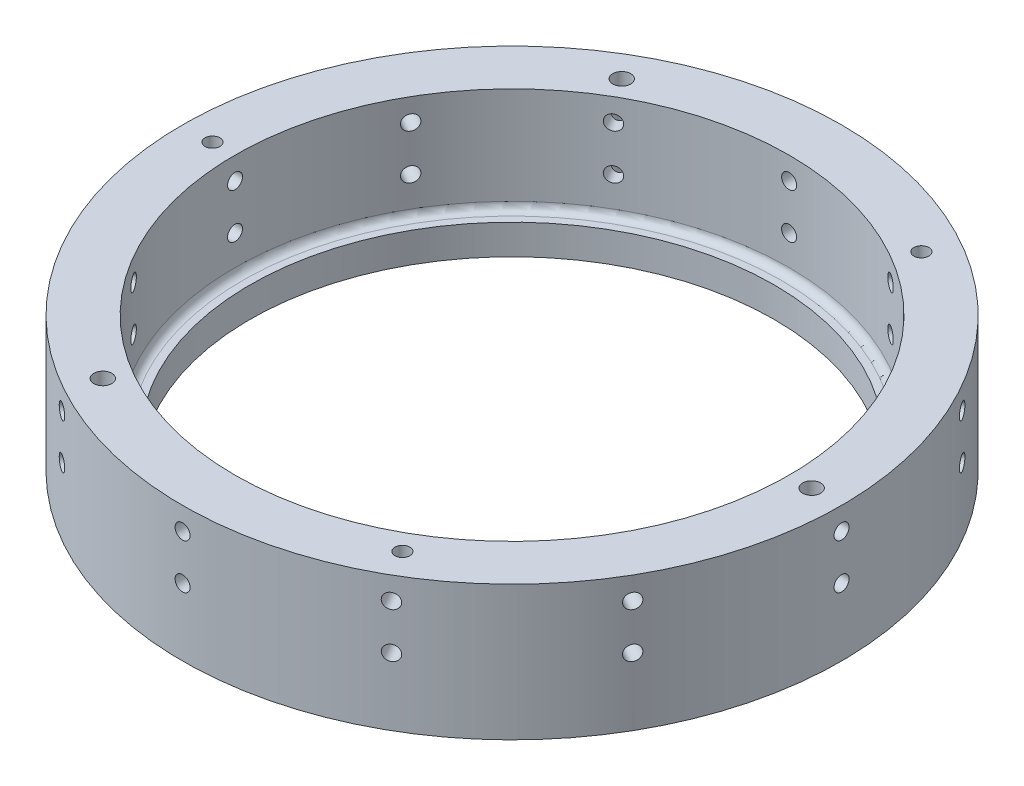
from build123d import *

# Parameters (mm, degrees)
SKETCH_2_R                          = 3
CUT_EXTRUDE_1_DEPTH                 = 162.941347407
SKETCH_8_W                          = 2.5
SKETCH_8_H                          = 110
HOLE_WIZARD_M6_3_AT_2_COUNT         = 2
HOLE_WIZARD_M6_3_AT_2_PITCH         = 15
SKETCH_9_R                          = 2.5
CUT_EXTRUDE_2_DEPTH                 = 162.941347571
PATTERN_CIRCULAR_1_COUNT            = 3
FILLET_1_R                          = 2.5
PATTERN_CIRCULAR_2_COUNT            = 12
PATTERN_CIRCULAR_2_COPY_1_SKETCH_W  = 2.5
PATTERN_CIRCULAR_2_COPY_1_SKETCH_H  = 110
PATTERN_CIRCULAR_2_COPY_2_SKETCH_W  = 2.5
PATTERN_CIRCULAR_2_COPY_2_SKETCH_H  = 110
PATTERN_CIRCULAR_2_COPY_3_SKETCH_W  = 2.5
PATTERN_CIRCULAR_2_COPY_3_SKETCH_H  = 110
PATTERN_CIRCULAR_2_COPY_4_SKETCH_W  = 2.5
PATTERN_CIRCULAR_2_COPY_4_SKETCH_H  = 110
PATTERN_CIRCULAR_2_COPY_5_SKETCH_W  = 2.5
PATTERN_CIRCULAR_2_COPY_5_SKETCH_H  = 110
PATTERN_CIRCULAR_2_COPY_6_SKETCH_W  = 2.5
PATTERN_CIRCULAR_2_COPY_6_SKETCH_H  = 110
PATTERN_CIRCULAR_2_COPY_7_SKETCH_W  = 2.5
PATTERN_CIRCULAR_2_COPY_7_SKETCH_H  = 110
PATTERN_CIRCULAR_2_COPY_8_SKETCH_W  = 2.5
PATTERN_CIRCULAR_2_COPY_8_SKETCH_H  = 110
PATTERN_CIRCULAR_2_COPY_9_SKETCH_W  = 2.5
PATTERN_CIRCULAR_2_COPY_9_SKETCH_H  = 110
PATTERN_CIRCULAR_2_COPY_10_SKETCH_W = 2.5
PATTERN_CIRCULAR_2_COPY_10_SKETCH_H = 110
PATTERN_CIRCULAR_2_COPY_11_SKETCH_W = 2.5
PATTERN_CIRCULAR_2_COPY_11_SKETCH_H = 110


with BuildPart() as part:
    # 草图1 → 旋转1 (revolve)
    with BuildSketch(Plane(origin=(0, 0, 0), x_dir=(0, 0, -1), z_dir=(1, 0, 0)), mode=Mode.PRIVATE) as revolve_1_sk:
        Polygon((-110, 45), (-110, 0), (-87.5, 0), (-87.5, 10), (-92.5, 10), (-92.5, 45), align=None)
    revolve(revolve_1_sk.sketch.rotate(Axis((0, 0, 0), (0, 1, 0)), 180), axis=Axis((0, 0, 0), (0, 1, 0)))

    # 草图2 → 切除-拉伸1 (cut, through all)
    with BuildSketch(Plane(origin=(0, 45, 0), x_dir=(1, 0, 0), z_dir=(0, 1, 0))):
        with Locations(Location((100, 0, 0), (0, 0, 270))):
            Circle(SKETCH_2_R)
    cut_extrude_1 = extrude(amount=-CUT_EXTRUDE_1_DEPTH, mode=Mode.SUBTRACT)

    # 草图4 → M6 螺纹孔1 (revolve, cut)
    with BuildSketch(Plane(origin=(-100, 45, 0), x_dir=(0, 0, 1), z_dir=(1, 0, 0))):
        Polygon((0, 0), (0, 16.502151548), (2.5, 15), (2.5, 0), align=None)
    hole_wizard_m6_1 = revolve(axis=Axis((-100, 51.35, 0), (0, -1, 0)), mode=Mode.SUBTRACT)

    # 草图8 → M6 螺纹孔3 (revolve, cut)
    with BuildSketch(Plane(origin=(0, 37.5, 0), x_dir=(0, 1, 0), z_dir=(1, 0, 0))):
        with Locations((1.25, 55)):
            Rectangle(SKETCH_8_W, SKETCH_8_H)
    hole_wizard_m6_3 = revolve(axis=Axis((0, 37.5, -6.35), (0, 0, 1)), mode=Mode.SUBTRACT)

    # M6 螺纹孔3 at 2: M6 螺纹孔3 ×2
    with Locations(*[(0, -i * HOLE_WIZARD_M6_3_AT_2_PITCH, 0) for i in range(1, HOLE_WIZARD_M6_3_AT_2_COUNT)]):
        add(hole_wizard_m6_3, mode=Mode.SUBTRACT)

    # 草图9 → 切除-拉伸2 (cut, through all)
    with BuildSketch(Plane(origin=(0, 45, 0), x_dir=(1, 0, 0), z_dir=(0, 1, 0))):
        with Locations(Location((-100, 0, 0), (0, 0, 270))):
            Circle(SKETCH_9_R)
    cut_extrude_2 = extrude(amount=-CUT_EXTRUDE_2_DEPTH, mode=Mode.SUBTRACT)

    # 阵列(圆周)1: 切除-拉伸1, M6 螺纹孔1, 切除-拉伸2 ×3 about axis
    pattern_circular_1_axis = Axis((0, 0, 0), (0, 1, 0))
    add([cut_extrude_1.rotate(pattern_circular_1_axis, i * 360 / PATTERN_CIRCULAR_1_COUNT) for i in range(1, PATTERN_CIRCULAR_1_COUNT)], mode=Mode.SUBTRACT)
    add([hole_wizard_m6_1.rotate(pattern_circular_1_axis, i * 360 / PATTERN_CIRCULAR_1_COUNT) for i in range(1, PATTERN_CIRCULAR_1_COUNT)], mode=Mode.SUBTRACT)
    add([cut_extrude_2.rotate(pattern_circular_1_axis, i * 360 / PATTERN_CIRCULAR_1_COUNT) for i in range(1, PATTERN_CIRCULAR_1_COUNT)], mode=Mode.SUBTRACT)

    # 圆角1
    fillet_1_edges = [part.edges().sort_by_distance(p)[0] for p in [
        (0, 10, 92.5),
    ]]
    fillet(fillet_1_edges, radius=FILLET_1_R)

    # 阵列(圆周)2: M6 螺纹孔3 ×12 about axis
    pattern_circular_2_axis = Axis((0, 0, 0), (0, -1, 0))
    for i in range(1, PATTERN_CIRCULAR_2_COUNT):
        add(hole_wizard_m6_3.rotate(pattern_circular_2_axis, i * 360 / PATTERN_CIRCULAR_2_COUNT), mode=Mode.SUBTRACT)

    # 阵列(圆周)2 copy 1 sketch → 阵列(圆周)2 copy 1 (revolve, cut)
    with BuildSketch(Plane(origin=(0, 22.5, 0), x_dir=(0, 1, 0), z_dir=(0.8660254037844387, 0, 0.49999999999999994))):
        with Locations((1.25, 55)):
            Rectangle(PATTERN_CIRCULAR_2_COPY_1_SKETCH_W, PATTERN_CIRCULAR_2_COPY_1_SKETCH_H)
    revolve(axis=Axis((3.175, 22.5, -5.499261314), (-0.49999999999999994, 0, 0.8660254037844387)), mode=Mode.SUBTRACT)

    # 阵列(圆周)2 copy 2 sketch → 阵列(圆周)2 copy 2 (revolve, cut)
    with BuildSketch(Plane(origin=(0, 22.5, 0), x_dir=(0, 1, 0), z_dir=(0.5000000000000001, 0, 0.8660254037844386))):
        with Locations((1.25, 55)):
            Rectangle(PATTERN_CIRCULAR_2_COPY_2_SKETCH_W, PATTERN_CIRCULAR_2_COPY_2_SKETCH_H)
    revolve(axis=Axis((5.499261314, 22.5, -3.175), (-0.8660254037844386, 0, 0.5000000000000001)), mode=Mode.SUBTRACT)

    # 阵列(圆周)2 copy 3 sketch → 阵列(圆周)2 copy 3 (revolve, cut)
    with BuildSketch(Plane(origin=(0, 22.5, 0), x_dir=(0, 1, 0), z_dir=(0, 0, 1))):
        with Locations((1.25, 55)):
            Rectangle(PATTERN_CIRCULAR_2_COPY_3_SKETCH_W, PATTERN_CIRCULAR_2_COPY_3_SKETCH_H)
    revolve(axis=Axis((6.35, 22.5, 0), (-1, 0, 0)), mode=Mode.SUBTRACT)

    # 阵列(圆周)2 copy 4 sketch → 阵列(圆周)2 copy 4 (revolve, cut)
    with BuildSketch(Plane(origin=(0, 22.5, 0), x_dir=(0, 1, 0), z_dir=(-0.4999999999999998, 0, 0.8660254037844387))):
        with Locations((1.25, 55)):
            Rectangle(PATTERN_CIRCULAR_2_COPY_4_SKETCH_W, PATTERN_CIRCULAR_2_COPY_4_SKETCH_H)
    revolve(axis=Axis((5.499261314, 22.5, 3.175), (-0.8660254037844387, 0, -0.4999999999999998)), mode=Mode.SUBTRACT)

    # 阵列(圆周)2 copy 5 sketch → 阵列(圆周)2 copy 5 (revolve, cut)
    with BuildSketch(Plane(origin=(0, 22.5, 0), x_dir=(0, 1, 0), z_dir=(-0.8660254037844387, 0, 0.49999999999999994))):
        with Locations((1.25, 55)):
            Rectangle(PATTERN_CIRCULAR_2_COPY_5_SKETCH_W, PATTERN_CIRCULAR_2_COPY_5_SKETCH_H)
    revolve(axis=Axis((3.175, 22.5, 5.499261314), (-0.49999999999999994, 0, -0.8660254037844387)), mode=Mode.SUBTRACT)

    # 阵列(圆周)2 copy 6 sketch → 阵列(圆周)2 copy 6 (revolve, cut)
    with BuildSketch(Plane(origin=(0, 22.5, 0), x_dir=(0, 1, 0), z_dir=(-1, 0, 0))):
        with Locations((1.25, 55)):
            Rectangle(PATTERN_CIRCULAR_2_COPY_6_SKETCH_W, PATTERN_CIRCULAR_2_COPY_6_SKETCH_H)
    revolve(axis=Axis((0, 22.5, 6.35), (0, 0, -1)), mode=Mode.SUBTRACT)

    # 阵列(圆周)2 copy 7 sketch → 阵列(圆周)2 copy 7 (revolve, cut)
    with BuildSketch(Plane(origin=(0, 22.5, 0), x_dir=(0, 1, 0), z_dir=(-0.8660254037844386, 0, -0.5000000000000001))):
        with Locations((1.25, 55)):
            Rectangle(PATTERN_CIRCULAR_2_COPY_7_SKETCH_W, PATTERN_CIRCULAR_2_COPY_7_SKETCH_H)
    revolve(axis=Axis((-3.175, 22.5, 5.499261314), (0.5000000000000001, 0, -0.8660254037844386)), mode=Mode.SUBTRACT)

    # 阵列(圆周)2 copy 8 sketch → 阵列(圆周)2 copy 8 (revolve, cut)
    with BuildSketch(Plane(origin=(0, 22.5, 0), x_dir=(0, 1, 0), z_dir=(-0.5000000000000004, 0, -0.8660254037844384))):
        with Locations((1.25, 55)):
            Rectangle(PATTERN_CIRCULAR_2_COPY_8_SKETCH_W, PATTERN_CIRCULAR_2_COPY_8_SKETCH_H)
    revolve(axis=Axis((-5.499261314, 22.5, 3.175), (0.8660254037844384, 0, -0.5000000000000004)), mode=Mode.SUBTRACT)

    # 阵列(圆周)2 copy 9 sketch → 阵列(圆周)2 copy 9 (revolve, cut)
    with BuildSketch(Plane(origin=(0, 22.5, 0), x_dir=(0, 1, 0), z_dir=(0, 0, -1))):
        with Locations((1.25, 55)):
            Rectangle(PATTERN_CIRCULAR_2_COPY_9_SKETCH_W, PATTERN_CIRCULAR_2_COPY_9_SKETCH_H)
    revolve(axis=Axis((-6.35, 22.5, 0), (1, 0, 0)), mode=Mode.SUBTRACT)

    # 阵列(圆周)2 copy 10 sketch → 阵列(圆周)2 copy 10 (revolve, cut)
    with BuildSketch(Plane(origin=(0, 22.5, 0), x_dir=(0, 1, 0), z_dir=(0.5000000000000001, 0, -0.8660254037844386))):
        with Locations((1.25, 55)):
            Rectangle(PATTERN_CIRCULAR_2_COPY_10_SKETCH_W, PATTERN_CIRCULAR_2_COPY_10_SKETCH_H)
    revolve(axis=Axis((-5.499261314, 22.5, -3.175), (0.8660254037844386, 0, 0.5000000000000001)), mode=Mode.SUBTRACT)

    # 阵列(圆周)2 copy 11 sketch → 阵列(圆周)2 copy 11 (revolve, cut)
    with BuildSketch(Plane(origin=(0, 22.5, 0), x_dir=(0, 1, 0), z_dir=(0.8660254037844384, 0, -0.5000000000000004))):
        with Locations((1.25, 55)):
            Rectangle(PATTERN_CIRCULAR_2_COPY_11_SKETCH_W, PATTERN_CIRCULAR_2_COPY_11_SKETCH_H)
    revolve(axis=Axis((-3.175, 22.5, -5.499261314), (0.5000000000000004, 0, 0.8660254037844384)), mode=Mode.SUBTRACT)


solid = part.part
